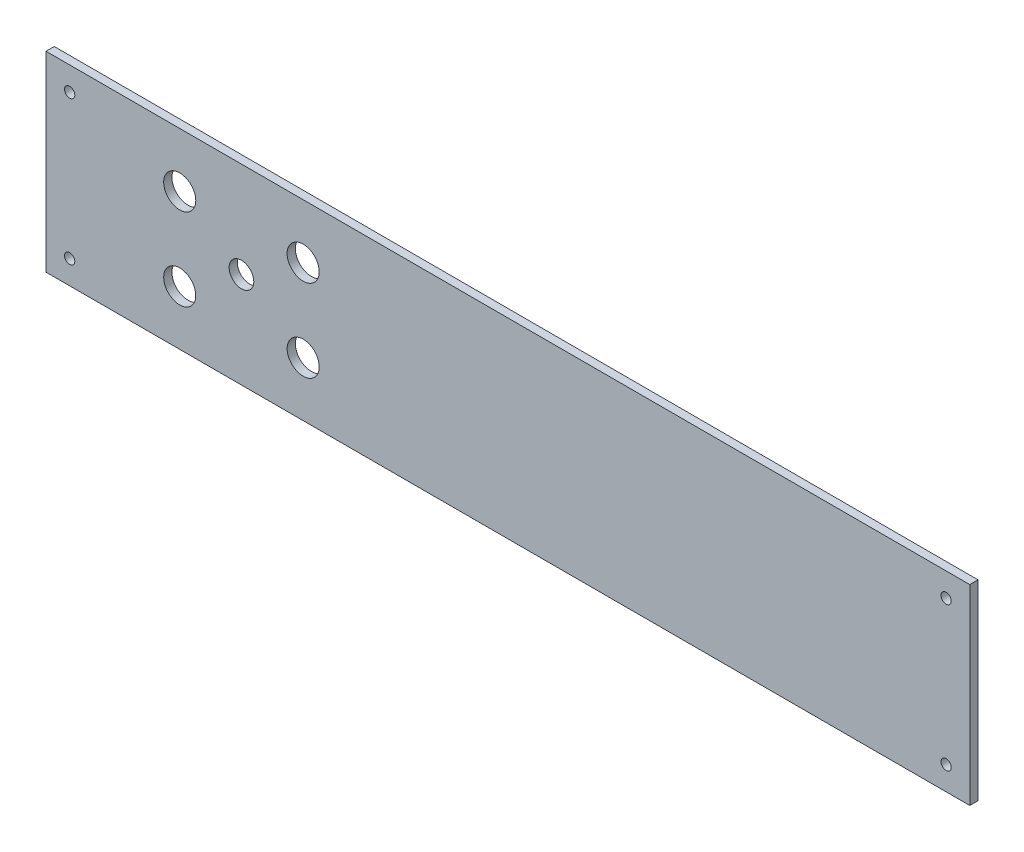
from build123d import *

# Parameters (mm, degrees)
SCHIZZO1_W                   = 449
SCHIZZO1_H                   = 93
SCHIZZO1_R                   = 7.8
SCHIZZO1_R_2                 = 2.5
SCHIZZO1_R_3                 = 6
ESTRUSIONE_ESTRUSIONE1_DEPTH = 4


with BuildPart() as part:
    # Schizzo1 → Estrusione-Estrusione1 (new body)
    with BuildSketch(Plane.XY):
        with Locations((-224.5, 46.5)):
            Rectangle(SCHIZZO1_W, SCHIZZO1_H)
        with Locations(Location((-384, 26.5, 0), (0, 0, 180))):
            Circle(SCHIZZO1_R, mode=Mode.SUBTRACT)
        with Locations((-437.5, 81.5)):
            Circle(SCHIZZO1_R_2, mode=Mode.SUBTRACT)
        with Locations(Location((-11.5, 81.5, 0), (0, 0, 180))):
            Circle(SCHIZZO1_R_2, mode=Mode.SUBTRACT)
        with Locations((-11.5, 11.5)):
            Circle(SCHIZZO1_R_2, mode=Mode.SUBTRACT)
        with Locations(Location((-437.5, 11.5, 0), (0, 0, 180))):
            Circle(SCHIZZO1_R_2, mode=Mode.SUBTRACT)
        with Locations((-324, 26.5)):
            Circle(SCHIZZO1_R, mode=Mode.SUBTRACT)
        with Locations(Location((-324, 66.5, 0), (0, 0, 180))):
            Circle(SCHIZZO1_R, mode=Mode.SUBTRACT)
        with Locations((-384, 66.5)):
            Circle(SCHIZZO1_R, mode=Mode.SUBTRACT)
        with Locations((-354, 46.5)):
            Circle(SCHIZZO1_R_3, mode=Mode.SUBTRACT)
    extrude(amount=ESTRUSIONE_ESTRUSIONE1_DEPTH)


solid = part.part
